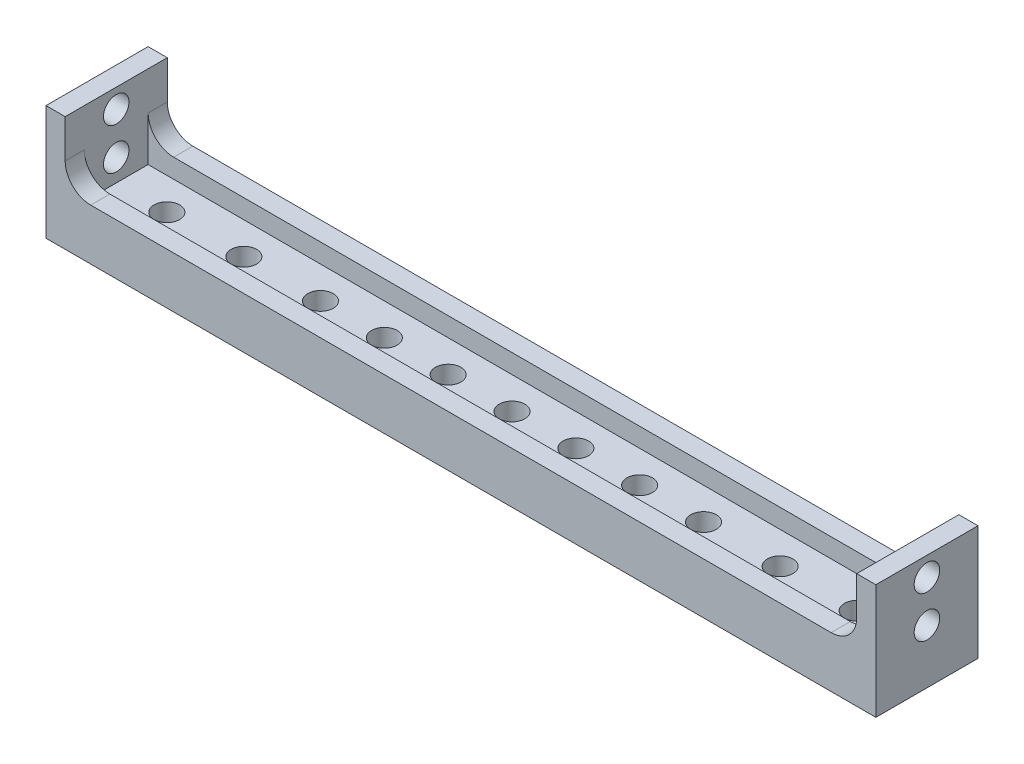
from build123d import *

# Parameters (mm, degrees)
SKETCH1_W               = 130
SKETCH1_H               = 16
BOSS_EXTRUDE1_DEPTH     = 5
SKETCH2_W               = 130
SKETCH2_H               = 16
SKETCH2_W_2             = 124
SKETCH2_H_2             = 10
BOSS_EXTRUDE2_DEPTH     = 3
SKETCH3_W               = 3
SKETCH3_H               = 16
BOSS_EXTRUDE3_DEPTH     = 10
FILLET1_R               = 4
SKETCH4_R               = 2
CUT_EXTRUDE1_DEPTH      = 10
SKETCH6_R               = 4
CUT_EXTRUDE2_DEPTH      = 2
SKETCH7_R               = 2
CUT_EXTRUDE3_DEPTH      = 5
CUT_EXTRUDE4_DEPTH      = 129.518481161
CUT_EXTRUDE4_DEPTH_BACK = 129.518481161
SKETCH8_R               = 2


with BuildPart() as part:
    # Sketch1 → Boss-Extrude1 (new body)
    with BuildSketch(Plane(origin=(0, 0, 0), x_dir=(1, 0, 0), z_dir=(0, 1, 0))):
        Rectangle(SKETCH1_W, SKETCH1_H)
    extrude(amount=BOSS_EXTRUDE1_DEPTH)

    # Sketch2 → Boss-Extrude2 (add)
    with BuildSketch(Plane(origin=(0, 5, 0), x_dir=(1, 0, 0), z_dir=(0, 1, 0))):
        Rectangle(SKETCH2_W, SKETCH2_H)
        Rectangle(SKETCH2_W_2, SKETCH2_H_2, mode=Mode.SUBTRACT)
    extrude(amount=BOSS_EXTRUDE2_DEPTH)

    # Sketch3 → Boss-Extrude3 (add)
    with BuildSketch(Plane(origin=(0, 8, 0), x_dir=(1, 0, 0), z_dir=(0, 1, 0))):
        with Locations((-63.5, 0)):
            Rectangle(SKETCH3_W, SKETCH3_H)
        with Locations((63.5, 0)):
            Rectangle(SKETCH3_W, SKETCH3_H)
    extrude(amount=BOSS_EXTRUDE3_DEPTH)

    # Fillet1
    fillet1_edges = [part.edges().sort_by_distance(p)[0] for p in [
        (-62, 8, -6.5),
        (-62, 8, 6.5),
        (62, 8, -6.5),
        (62, 8, 6.5),
    ]]
    fillet(fillet1_edges, radius=FILLET1_R)

    # Sketch4 → Cut-Extrude1 (cut)
    with BuildSketch(Plane(origin=(0, 5, 0), x_dir=(1, 0, 0), z_dir=(0, 1, 0))):
        with Locations(Location((42, 0, 0), (0, 0, 270))):
            Circle(SKETCH4_R)
        with Locations(Location((-42, 0, 0), (0, 0, 270))):
            Circle(SKETCH4_R)
    extrude(amount=-CUT_EXTRUDE1_DEPTH, mode=Mode.SUBTRACT)

    # Sketch6 → Cut-Extrude2 (cut)
    with BuildSketch(Plane.XZ):
        with Locations(Location((42, 0, 0), (0, 0, 270))):
            Circle(SKETCH6_R)
        with Locations(Location((-42, 0, 0), (0, 0, 270))):
            Circle(SKETCH6_R)
    extrude(amount=-CUT_EXTRUDE2_DEPTH, mode=Mode.SUBTRACT)

    # Sketch7 → Cut-Extrude3 (cut)
    with BuildSketch(Plane(origin=(0, 5, 0), x_dir=(1, 0, 0), z_dir=(0, 1, 0))):
        with Locations(Location((0, 0, 0), (0, 0, 270))):
            Circle(SKETCH7_R)
        with Locations(Location((-10, 0, 0), (0, 0, 270))):
            Circle(SKETCH7_R)
        with Locations(Location((-20, 0, 0), (0, 0, 270))):
            Circle(SKETCH7_R)
        with Locations(Location((-30, 0, 0), (0, 0, 270))):
            Circle(SKETCH7_R)
        with Locations(Location((-54.066395838, 0, 0), (0, 0, 270))):
            Circle(SKETCH7_R)
        with Locations(Location((54.066395838, 0, 0), (0, 0, 90))):
            Circle(SKETCH7_R)
        with Locations(Location((30, 0, 0), (0, 0, 90))):
            Circle(SKETCH7_R)
        with Locations(Location((20, 0, 0), (0, 0, 90))):
            Circle(SKETCH7_R)
        with Locations(Location((10, 0, 0), (0, 0, 90))):
            Circle(SKETCH7_R)
    extrude(amount=-CUT_EXTRUDE3_DEPTH, mode=Mode.SUBTRACT)

    # Sketch8 → Cut-Extrude4 (cut, two sides: drawn at the far end of the back side and taken through both)
    with BuildSketch(Plane(origin=(-62, 0, 0), x_dir=(0, 0, -1), z_dir=(1, 0, 0)).offset(-CUT_EXTRUDE4_DEPTH_BACK)):
        with Locations((0, 8.5)):
            Circle(SKETCH8_R)
        with Locations((0, 15)):
            Circle(SKETCH8_R)
    extrude(amount=CUT_EXTRUDE4_DEPTH + CUT_EXTRUDE4_DEPTH_BACK, mode=Mode.SUBTRACT)


solid = part.part
